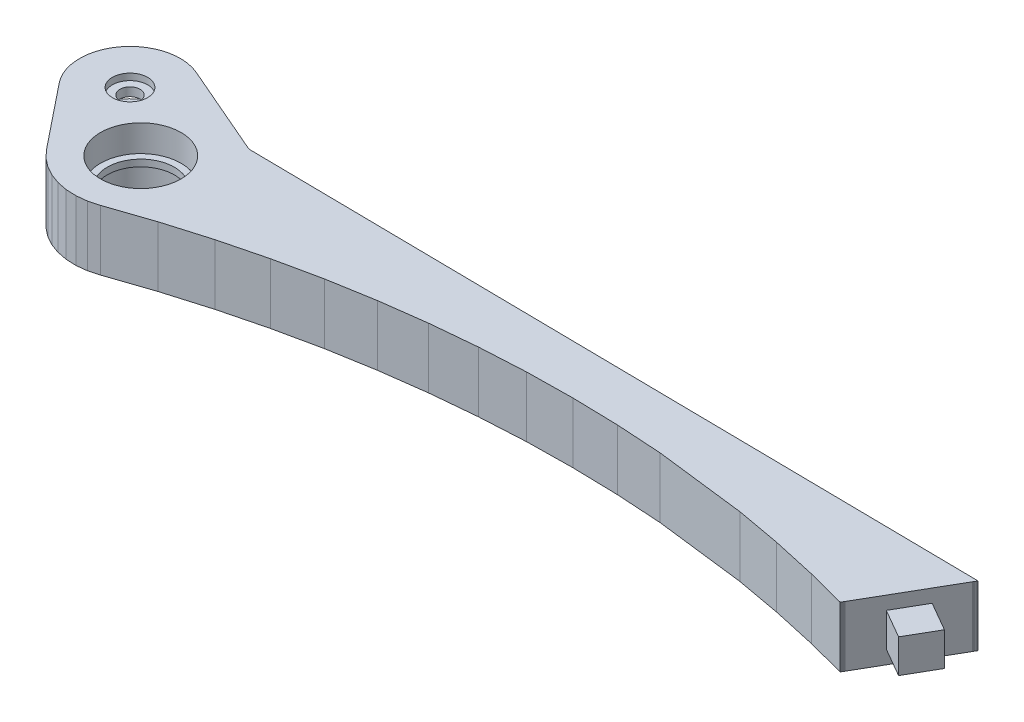
from build123d import *

# Parameters (mm, degrees)
EXTRUDE_2_DEPTH     = 18
EXTRUDE_3_DEPTH     = 18
CUT_EXTRUDE_1_DEPTH = 274.954545633
CUT_EXTRUDE_START   = 4.5
CUT_EXTRUDE_8_DEPTH = 9
SKETCH_12_R         = 3.000000492
CUT_EXTRUDE_2_DEPTH = 274.760361364
SKETCH_19_R         = 5.250000395
CUT_EXTRUDE_3_DEPTH = 274.901063636
SKETCH_28_R         = 12.000002389
CUT_EXTRUDE_5_DEPTH = 274.610814509
SKETCH_37_R         = 9.999999776
CUT_EXTRUDE_6_DEPTH = 274.614911801
SKETCH_47_R         = 12.000000104
CUT_EXTRUDE_7_DEPTH = 274.614911801
EXTRUDE_4_DEPTH     = 10
SKETCH_51_R         = 3.000000989
CUT_EXTRUDE_9_DEPTH = 5


with BuildPart() as part:
    # Эскиз49 → Бобышка-Вытянуть2 (new body)
    with BuildSketch(Plane(origin=(0, 0, 0), x_dir=(1, 0, 0), z_dir=(0, 1, 0))):
        with BuildLine():
            Line((268.063783646, -16.98423177), (254.129260778, -41.119493544))
            Line((254.129260778, -41.119493544), (254.045069218, -41.265372187))
            Line((254.045069218, -41.265372187), (253.964364529, -41.405163705))
            Line((253.964364529, -41.405163705), (253.954172134, -41.422776878))
            Line((253.954172134, -41.422776878), (253.894984722, -41.525326669))
            Line((253.894984722, -41.525326669), (253.878325224, -41.554179043))
            Line((253.878325224, -41.554179043), (253.81013751, -41.672233492))
            Line((253.81013751, -41.672233492), (253.79884243, -41.691847146))
            Line((253.79884243, -41.691847146), (253.764301538, -41.751608253))
            Line((253.764301538, -41.751608253), (253.740429878, -41.792999953))
            Line((253.740429878, -41.792999953), (253.711700439, -41.842740029))
            Line((253.711700439, -41.842740029), (253.692567348, -41.875883937))
            Line((253.692567348, -41.875883937), (253.683686256, -41.891265661))
            Line((253.683686256, -41.891265661), (253.64869833, -41.951872408))
            Line((253.64869833, -41.951872408), (253.638356924, -41.969776154))
            Line((253.638356924, -41.969776154), (253.625631332, -41.991844773))
            Line((253.625631332, -41.991844773), (253.622353077, -41.997496039))
            Line((253.622353077, -41.997496039), (253.619432449, -42.002540082))
            Line((253.619432449, -42.002540082), (253.613084555, -42.01355204))
            Line((253.613084555, -42.01355204), (241.948843002, -38.973722607))
            Line((241.948843002, -38.973722607), (228.663310409, -36.026842892))
            Line((228.663310409, -36.026842892), (215.273305774, -33.598650247))
            Line((215.273305774, -33.598650247), (188.260793686, -30.312221497))
            Line((188.260793686, -30.312221497), (174.679160118, -29.458951205))
            Line((174.679160118, -29.458951205), (161.074608564, -29.134295881))
            Line((161.074608564, -29.134295881), (147.467300296, -29.326442629))
            Line((147.467300296, -29.326442629), (133.879095316, -30.07199429))
            Line((133.879095316, -30.07199429), (120.329216123, -31.332932413))
            Line((120.329216123, -31.332932413), (106.838598847, -33.11965242))
            Line((106.838598847, -33.11965242), (93.425318599, -35.417359322))
            Line((93.425318599, -35.417359322), (80.116614699, -38.258839399))
            Line((80.116614699, -38.258839399), (66.925637424, -41.603542864))
            Line((66.925637424, -41.603542864), (53.874649107, -45.458499342))
            Line((53.874649107, -45.458499342), (40.983382612, -49.817882478))
            Line((40.983382612, -49.817882478), (37.993647158, -50.638716668))
            Line((37.993647158, -50.638716668), (34.912444651, -50.972435623))
            Line((34.912444651, -50.972435623), (31.815398484, -50.856206566))
            Line((31.815398484, -50.856206566), (28.775347397, -50.247631967))
            Line((28.775347397, -50.247631967), (25.86587891, -49.176525325))
            Line((25.86587891, -49.176525325), (23.165307939, -47.655962408))
            Line((23.165307939, -47.655962408), (20.723795518, -45.748956501))
            Line((20.723795518, -45.748956501), (18.606347963, -43.487519026))
            Line((18.606347963, -43.487519026), (22.888580337, -40.060333908))
            ThreePointArc((22.888580337, -40.060333908), (20.515961233, -26.231308511), (30.96540831, -16.867531464))
            Line((30.96540831, -16.867531464), (48.057679087, -12.944173068))
            Line((48.057679087, -12.944173068), (48.429638147, -13.076597825))
            Line((48.429638147, -13.076597825), (48.815764487, -13.159029186))
            Line((48.815764487, -13.159029186), (49.209374934, -13.19003664))
            Line((49.209374934, -13.19003664), (268.63694191, -15.991469845))
            Line((268.63694191, -15.991469845), (268.63476634, -15.995245427))
            Line((268.63476634, -15.995245427), (268.628239632, -16.006551683))
            Line((268.628239632, -16.006551683), (268.617421389, -16.025297344))
            Line((268.617421389, -16.025297344), (268.602401018, -16.051340848))
            Line((268.602401018, -16.051340848), (268.583238125, -16.084482893))
            Line((268.583238125, -16.084482893), (268.560141325, -16.124473885))
            Line((268.560141325, -16.124473885), (268.533289433, -16.171008348))
            Line((268.533289433, -16.171008348), (268.502831459, -16.223732382))
            Line((268.502831459, -16.223732382), (268.432199955, -16.34609513))
            Line((268.432199955, -16.34609513), (268.350362778, -16.487849876))
            Line((268.350362778, -16.487849876), (268.259823322, -16.644688323))
            Line((268.259823322, -16.644688323), (268.1632936, -16.811842099))
            Line((268.1632936, -16.811842099), (268.063783646, -16.98423177))
        make_face()
    extrude(amount=EXTRUDE_2_DEPTH)

    # Эскиз50 → Бобышка-Вытянуть3 (add)
    with BuildSketch(Plane(origin=(0, 0, 0), x_dir=(1, 0, 0), z_dir=(0, 1, 0))):
        with BuildLine():
            Line((18.606347963, -43.487519026), (3.320188681, -24.411882))
            ThreePointArc((3.320188681, -24.411882), (3.075097683, -5.921043708), (20.964451369, -1.236794031))
            Line((20.964451369, -1.236794031), (48.057679087, -12.944173068))
            Line((48.057679087, -12.944173068), (30.96540831, -16.867531464))
            ThreePointArc((30.96540831, -16.867531464), (20.515961233, -26.231308511), (22.888580337, -40.060333908))
            Line((22.888580337, -40.060333908), (18.606347963, -43.487519026))
        make_face()
    extrude(amount=EXTRUDE_3_DEPTH)

    # Эскиз6 → Вырез-Вытянуть1 (cut, through all)
    with BuildSketch(Plane(origin=(0, 1.056053559, 0), x_dir=(1, 0, 0), z_dir=(0, 1, 0))):
        Polygon((12.516560033, -19.261443987), (12.784916908, -19.463635981), (13.083335012, -19.618049264), (13.830723241, -19.861357287), (14.607004821, -19.984532148), (15.392998233, -19.984532148), (16.169279814, -19.861357287), (16.916668043, -19.618049264), (17.215086147, -19.463635981), (17.483444884, -19.261443987), (17.714165151, -19.017178565), (17.900740728, -18.737738952), (18.037900329, -18.431009725), (18.121777102, -18.105644733), (18.150001764, -17.770830542), (18.150001764, -12.229168788), (18.121777102, -11.894354597), (18.037900329, -11.568991467), (17.900740728, -11.262258515), (17.714165151, -10.982818902), (17.483444884, -10.738555342), (17.215086147, -10.536363348), (16.916668043, -10.381950065), (16.169279814, -10.138643906), (15.392998233, -10.015467182), (14.607004821, -10.015467182), (13.830723241, -10.138643906), (13.083335012, -10.381950065), (12.784916908, -10.536363348), (12.516560033, -10.738555342), (12.285837904, -10.982818902), (12.099262327, -11.262258515), (11.962102726, -11.568991467), (11.878225952, -11.894354597), (11.85000129, -12.229168788), (11.85000129, -17.770830542), (11.878225952, -18.105644733), (11.962102726, -18.431009725), (12.099262327, -18.737738952), (12.285837904, -19.017178565), align=None)
    extrude(amount=-CUT_EXTRUDE_1_DEPTH, mode=Mode.SUBTRACT)

    # Эскиз50<3> → Вырез-Вытянуть8 (cut)
    with BuildSketch(Plane(origin=(0, 0, 0), x_dir=(1, 0, 0), z_dir=(0, 1, 0)).offset(CUT_EXTRUDE_START)):
        with BuildLine():
            Line((18.606347963, -43.487519026), (3.320188681, -24.411882))
            ThreePointArc((3.320188681, -24.411882), (3.075097683, -5.921043708), (20.964451369, -1.236794031))
            Line((20.964451369, -1.236794031), (48.057679087, -12.944173068))
            Line((48.057679087, -12.944173068), (30.96540831, -16.867531464))
            ThreePointArc((30.96540831, -16.867531464), (20.515961233, -26.231308511), (22.888580337, -40.060333908))
            Line((22.888580337, -40.060333908), (18.606347963, -43.487519026))
        make_face()
    extrude(amount=CUT_EXTRUDE_8_DEPTH, mode=Mode.SUBTRACT)

    # Эскиз12 → Вырез-Вытянуть2 (cut, through all)
    with BuildSketch(Plane(origin=(0, 4.556053318, 0), x_dir=(1, 0, 0), z_dir=(0, 1, 0))):
        with Locations((15.000002459, -14.999998733)):
            Circle(SKETCH_12_R)
    extrude(amount=-CUT_EXTRUDE_2_DEPTH, mode=Mode.SUBTRACT)

    # Эскиз19 → Вырез-Вытянуть3 (cut, through all)
    with BuildSketch(Plane(origin=(0, 16.056055203, 0), x_dir=(-1, 0, 0), z_dir=(0, -1, 0))):
        with Locations((-15.000000345, -14.999999665)):
            Circle(SKETCH_19_R)
    extrude(amount=-CUT_EXTRUDE_3_DEPTH, mode=Mode.SUBTRACT)

    # Эскиз28 → Вырез-Вытянуть5 (cut, through all)
    with BuildSketch(Plane(origin=(0, 8.056053892, 0), x_dir=(1, 0, 0), z_dir=(0, 1, 0))):
        with Locations((34.209375704, -31.000001441)):
            Circle(SKETCH_28_R)
    extrude(amount=-CUT_EXTRUDE_5_DEPTH, mode=Mode.SUBTRACT)

    # Эскиз37 → Вырез-Вытянуть6 (cut, through all)
    with BuildSketch(Plane(origin=(0, 10.056053288, 0), x_dir=(1, 0, 0), z_dir=(0, 1, 0))):
        with Locations((34.209374338, -30.999999493)):
            Circle(SKETCH_37_R)
    extrude(amount=-CUT_EXTRUDE_6_DEPTH, mode=Mode.SUBTRACT)

    # Эскиз47 → Вырез-Вытянуть7 (cut, through all)
    with BuildSketch(Plane(origin=(0, 10.056053288, 0), x_dir=(-1, 0, 0), z_dir=(0, -1, 0))):
        with Locations((-34.209374338, -30.999999493)):
            Circle(SKETCH_47_R)
    extrude(amount=-CUT_EXTRUDE_7_DEPTH, mode=Mode.SUBTRACT)

    # Эскиз51 → Вырез-Вытянуть9 (cut)
    with BuildSketch(Plane(origin=(0, 16.056055203, 0), x_dir=(1, 0, 0), z_dir=(0, 1, 0))):
        with Locations((15.000000345, -14.999999665)):
            Circle(SKETCH_51_R)
    extrude(amount=-CUT_EXTRUDE_9_DEPTH, mode=Mode.SUBTRACT)


with BuildPart() as body_2:
    # Эскиз1 → Бобышка-Вытянуть4 (new body)
    with BuildSketch(Plane(origin=(0, 14.056053944, 0), x_dir=(1, 0, 0), z_dir=(0, 1, 0))):
        Polygon((263.636956116, -24.651711225), (258.636951447, -33.311977983), (267.297208309, -38.311976939), (272.297212979, -29.651710182), align=None)
    extrude(amount=-EXTRUDE_4_DEPTH)


solid = Compound([part.part, body_2.part])
